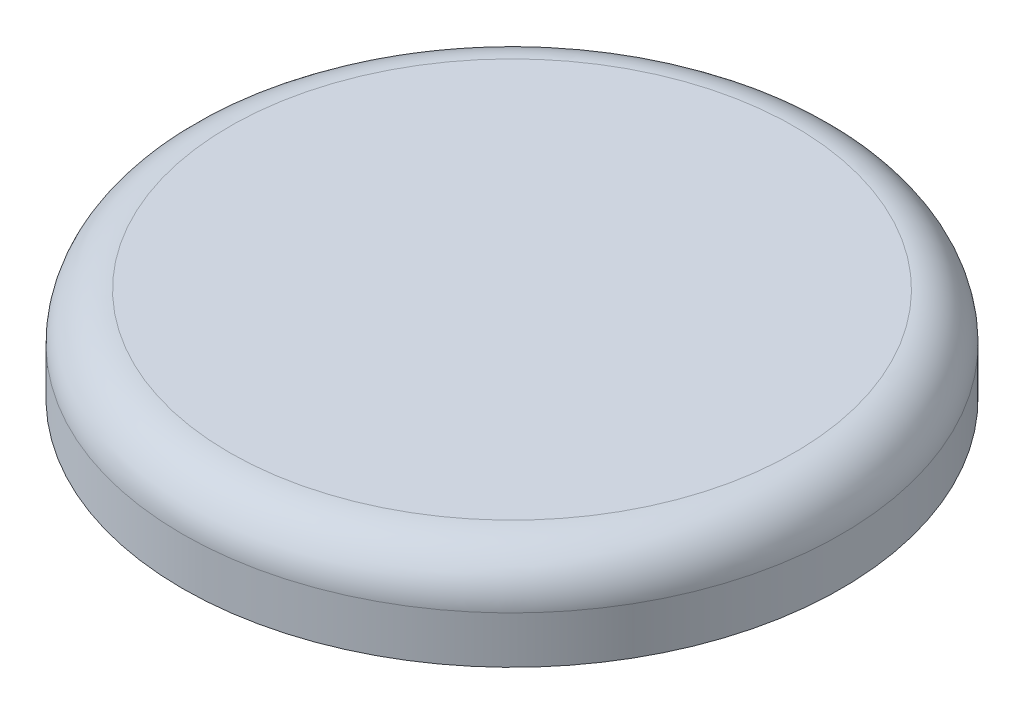
from build123d import *

# Parameters (mm, degrees)
SKETCH1_R           = 35
BOSS_EXTRUDE1_DEPTH = 10
FILLET1_R           = 5
SKETCH2_R           = 10
CUT_EXTRUDE1_DEPTH  = 5


with BuildPart() as part:
    # Sketch1 → Boss-Extrude1 (new body)
    with BuildSketch(Plane(origin=(0, 0, 0), x_dir=(1, 0, 0), z_dir=(0, 1, 0))):
        with Locations(Location((0, 0, 0), (0, 0, 270))):
            Circle(SKETCH1_R)
    extrude(amount=BOSS_EXTRUDE1_DEPTH)

    # Fillet1
    fillet1_edges = [part.edges().sort_by_distance(p)[0] for p in [
        (0, 10, -35),
    ]]
    fillet(fillet1_edges, radius=FILLET1_R)

    # Sketch2 → Cut-Extrude1 (cut)
    with BuildSketch(Plane.XZ):
        with Locations(Location((0, 0, 0), (0, 0, 270))):
            Circle(SKETCH2_R)
    extrude(amount=-CUT_EXTRUDE1_DEPTH, mode=Mode.SUBTRACT)


solid = part.part
